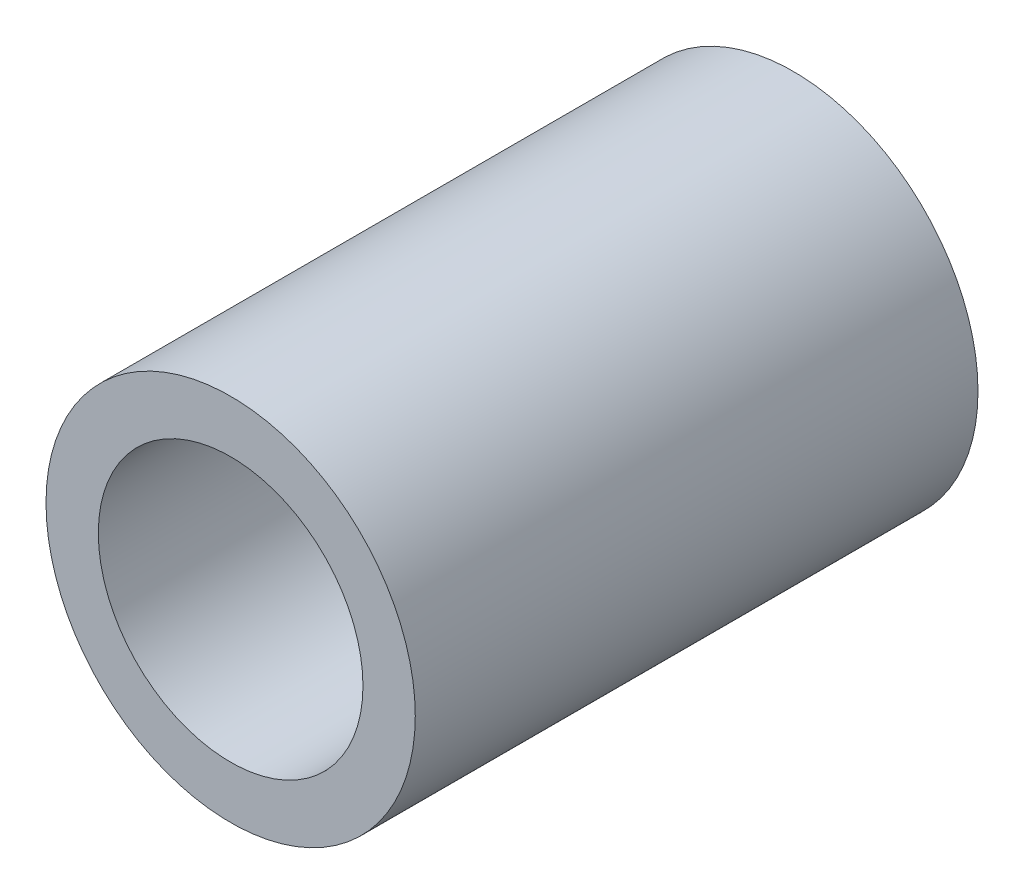
from build123d import *

# Parameters (mm, degrees)
SKETCH_1_R      = 10.5
SKETCH_1_R_2    = 4.5
EXTRUDE_1_DEPTH = 2
SKETCH_2_R      = 10.5
SKETCH_2_R_2    = 7.525
EXTRUDE_2_DEPTH = 15
EXTRUDE_START   = 15
SKETCH_3_R      = 10.5
SKETCH_3_R_2    = 7.525
EXTRUDE_3_DEPTH = 15


with BuildPart() as part:
    # 草图1 → 凸台-拉伸1 (new body)
    with BuildSketch(Plane.XY):
        Circle(SKETCH_1_R)
        Circle(SKETCH_1_R_2, mode=Mode.SUBTRACT)
    extrude(amount=EXTRUDE_1_DEPTH)

    # 草图2 → 凸台-拉伸2 (add)
    with BuildSketch(Plane.XY.offset(2)):
        Circle(SKETCH_2_R)
        Circle(SKETCH_2_R_2, mode=Mode.SUBTRACT)
    extrude(amount=EXTRUDE_2_DEPTH)

    # 草图3 → 凸台-拉伸3 (add)
    with BuildSketch(Plane(origin=(0, 0, 0), x_dir=(-1, 0, 0), z_dir=(0, 0, -1)).offset(EXTRUDE_START)):
        Circle(SKETCH_3_R)
        with Locations(Location((0, 0, 0), (0, 0, 180))):
            Circle(SKETCH_3_R_2, mode=Mode.SUBTRACT)
    extrude(amount=-EXTRUDE_3_DEPTH)


solid = part.part
